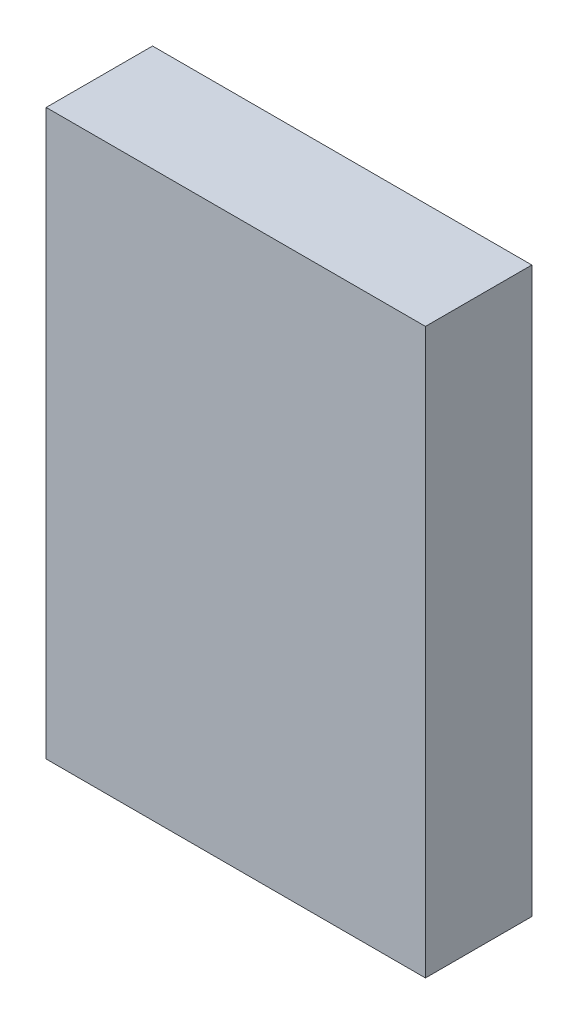
from build123d import *

# Parameters (mm, degrees)
SKETCH1_W           = 82
SKETCH1_H           = 122
BOSS_EXTRUDE1_DEPTH = 23
SKETCH2_W           = 76
SKETCH2_H           = 116
CUT_EXTRUDE1_DEPTH  = 21
SKETCH6_W           = 78
SKETCH6_H           = 118
CUT_EXTRUDE3_DEPTH  = 2


with BuildPart() as part:
    # Sketch1 → Boss-Extrude1 (new body)
    with BuildSketch(Plane.XY):
        Rectangle(SKETCH1_W, SKETCH1_H)
    extrude(amount=-BOSS_EXTRUDE1_DEPTH)

    # Sketch2 → Cut-Extrude1 (cut)
    with BuildSketch(Plane(origin=(0, 0, -23), x_dir=(-1, 0, 0), z_dir=(0, 0, -1))):
        Rectangle(SKETCH2_W, SKETCH2_H)
    extrude(amount=-CUT_EXTRUDE1_DEPTH, mode=Mode.SUBTRACT)

    # Sketch6 → Cut-Extrude3 (cut)
    with BuildSketch(Plane(origin=(0, 0, -23), x_dir=(-1, 0, 0), z_dir=(0, 0, -1))):
        Rectangle(SKETCH6_W, SKETCH6_H)
    extrude(amount=-CUT_EXTRUDE3_DEPTH, mode=Mode.SUBTRACT)


solid = part.part
